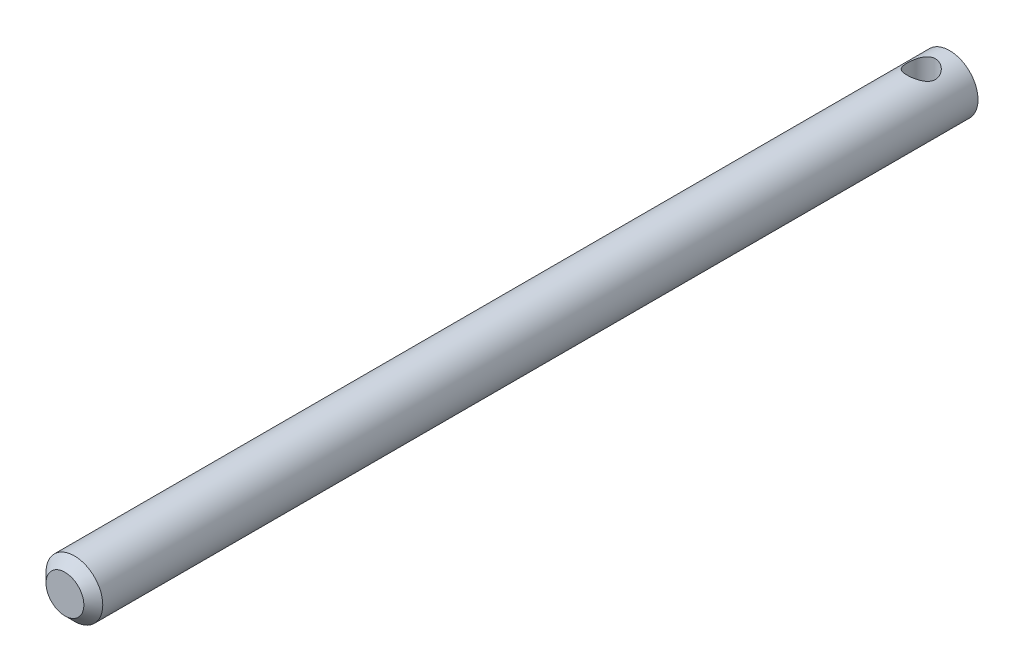
from build123d import *

# Parameters (mm, degrees)
ESQUISSE1_R                  = 3
BOSS_EXTRU_1_DEPTH           = 93.5
ENL_V_MAT_EXTRU_1_DEPTH      = 94.596207188
ENL_V_MAT_EXTRU_1_DEPTH_BACK = 94.596207188
ESQUISSE2_R                  = 1.5
CHANFREIN1_SIZE              = 1


with BuildPart() as part:
    # Esquisse1 → Boss.-Extru.1 (new body)
    with BuildSketch(Plane.XY):
        Circle(ESQUISSE1_R)
    extrude(amount=BOSS_EXTRU_1_DEPTH)

    # Esquisse2 → Enlèv. mat.-Extru.1 (cut, two sides: drawn at the far end of the back side and taken through both)
    with BuildSketch(Plane(origin=(0, 0, 0), x_dir=(1, 0, 0), z_dir=(0, 1, 0)).offset(-ENL_V_MAT_EXTRU_1_DEPTH_BACK)):
        with Locations(Location((0, -3, 0), (0, 0, 270))):
            Circle(ESQUISSE2_R)
    extrude(amount=ENL_V_MAT_EXTRU_1_DEPTH + ENL_V_MAT_EXTRU_1_DEPTH_BACK, mode=Mode.SUBTRACT)

    # Chanfrein1
    chanfrein1_edges = [part.edges().sort_by_distance(p)[0] for p in [
        (-3, 0, 93.5),
    ]]
    chamfer(chanfrein1_edges, length=CHANFREIN1_SIZE)


solid = part.part
